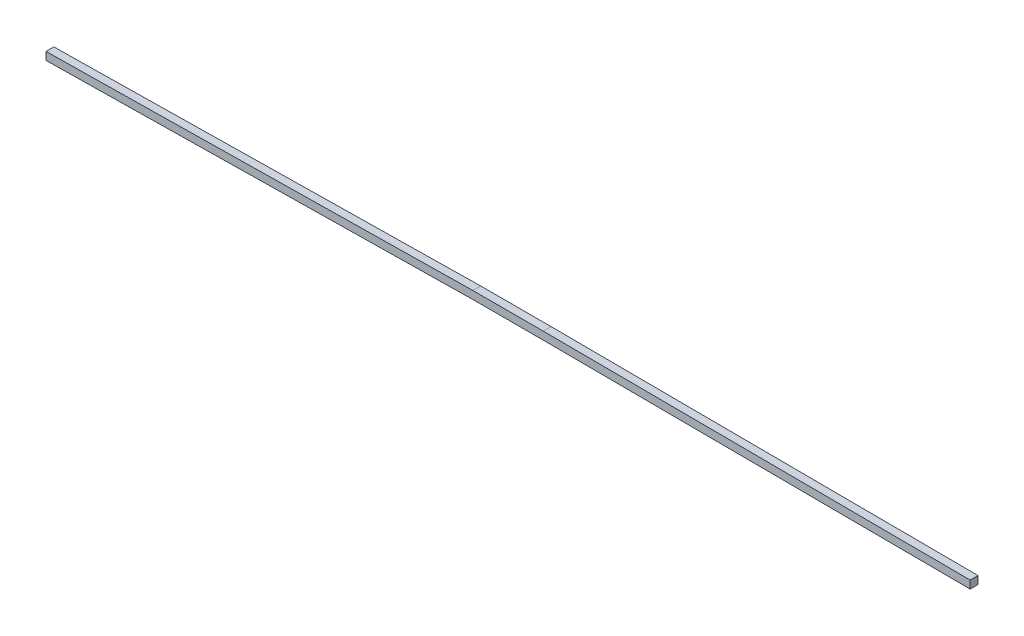
from build123d import *

# Parameters (mm, degrees)
EXTRUDE_1_DEPTH = 5


with BuildPart() as part:
    # Model → 凸台-拉伸1 (new body)
    with BuildSketch(Plane.XY):
        Polygon((775.816328778, 179.279481506), (503.220006076, 180.639481506), (458.220006076, 180.639481506), (185.650823304, 176.559609699), (185.650823304, 171.559609699), (458.294828458, 175.640041376), (503.294828458, 175.640041376), (775.816328778, 174.279481506), align=None)
    extrude(amount=EXTRUDE_1_DEPTH)


solid = part.part
